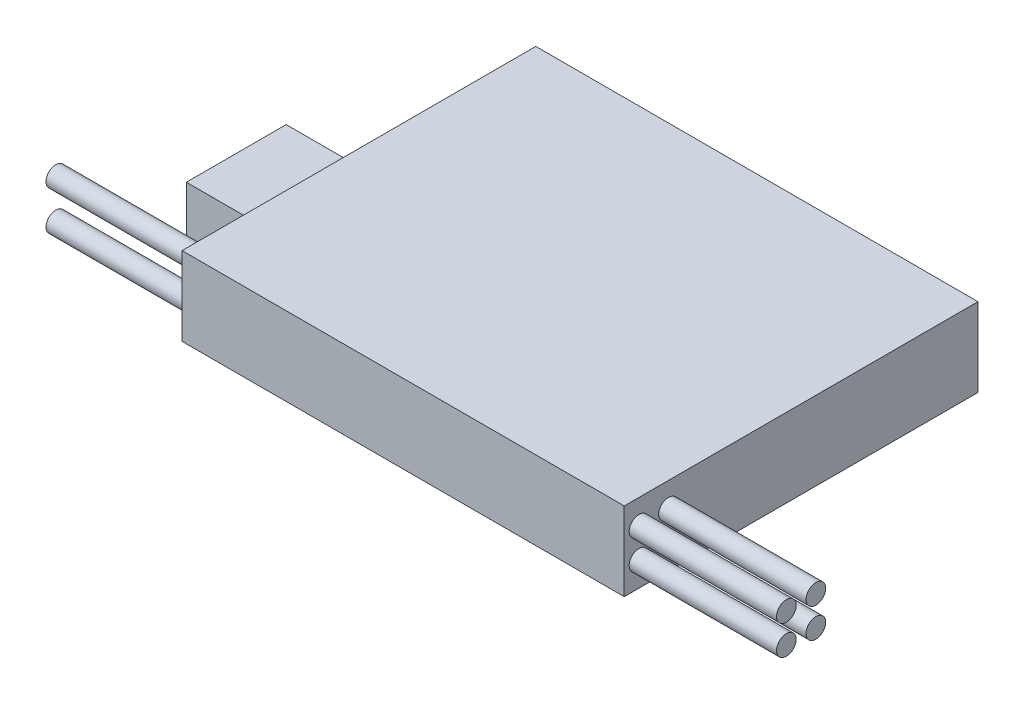
from build123d import *

# Parameters (mm, degrees)
ESQUISSE1_W        = 45
ESQUISSE1_H        = 36
BOSS_EXTRU_1_DEPTH = 8
ESQUISSE2_W        = 10.16
ESQUISSE2_H        = 7.62
BOSS_EXTRU_2_DEPTH = 6
ESQUISSE3_R        = 1
BOSS_EXTRU_3_DEPTH = 15
ESQUISSE4_R        = 1
BOSS_EXTRU_4_DEPTH = 15


with BuildPart() as part:
    # Esquisse1 → Boss.-Extru.1 (new body)
    with BuildSketch(Plane(origin=(0, 0, 0), x_dir=(1, 0, 0), z_dir=(0, 1, 0))):
        Rectangle(ESQUISSE1_W, ESQUISSE1_H)
    extrude(amount=BOSS_EXTRU_1_DEPTH)

    # Esquisse2 → Boss.-Extru.2 (add)
    with BuildSketch(Plane.ZY.offset(22.5)):
        with Locations((6.482241764, 4)):
            Rectangle(ESQUISSE2_W, ESQUISSE2_H)
    extrude(amount=BOSS_EXTRU_2_DEPTH)

    # Esquisse3 → Boss.-Extru.3 (add)
    with BuildSketch(Plane.ZY.offset(22.5)):
        with Locations(Location((15.846041743, 6, 0), (0, 0, 180))):
            Circle(ESQUISSE3_R)
        with Locations(Location((15.846041743, 2, 0), (0, 0, 180))):
            Circle(ESQUISSE3_R)
    extrude(amount=BOSS_EXTRU_3_DEPTH)

    # Esquisse4 → Boss.-Extru.4 (add)
    with BuildSketch(Plane(origin=(22.5, 0, 0), x_dir=(0, 0, -1), z_dir=(1, 0, 0))):
        with Locations(Location((-16.5, 5.5, 0), (0, 0, 180))):
            Circle(ESQUISSE4_R)
        with Locations(Location((-16.5, 2.5, 0), (0, 0, 180))):
            Circle(ESQUISSE4_R)
        with Locations(Location((-13.5, 2.5, 0), (0, 0, 180))):
            Circle(ESQUISSE4_R)
        with Locations(Location((-13.5, 5.5, 0), (0, 0, 180))):
            Circle(ESQUISSE4_R)
    extrude(amount=BOSS_EXTRU_4_DEPTH)


solid = part.part
